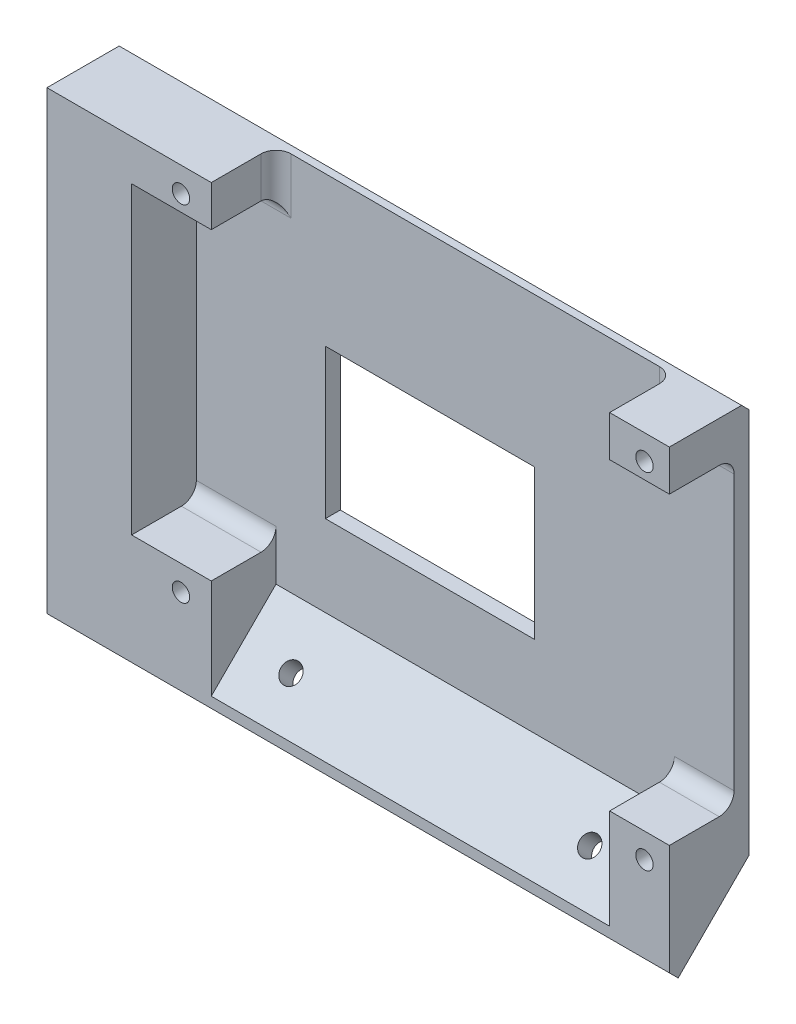
from build123d import *

# Parameters (mm, degrees)
SKETCH_1_W                  = 125
SKETCH_1_H                  = 95
EXTRUDE_1_DEPTH             = 16
SKETCH_3_R                  = 1.75
CUT_EXTRUDE_1_DEPTH         = 158.816348963
CUT_EXTRUDE_2_DEPTH         = 13
CUT_EXTRUDE_3_DEPTH         = 158.816348963
EXTRUDE_4_DEPTH             = 80
HOLE_WIZARD_4_0_4_1_D       = 4
SKETCH_11_W                 = 42
SKETCH_11_H                 = 30
CUT_EXTRUDE_4_DEPTH         = 158.540470991
FILLET_4_R                  = 3
CHAMFER_1_SIZE              = 2.5
CHAMFER_1_SIZE2             = 3.535533906
HOLE_WIZARD_2_5_2_5_1_D     = 2.5
HOLE_WIZARD_2_5_2_5_1_DEPTH = 16
HOLE_WIZARD_2_5_2_5_1_TIP   = 0.751075774
CHAMFER_2_SIZE              = 1.5


with BuildPart() as part:
    # 草图1 → 凸台-拉伸1 (new body)
    with BuildSketch(Plane.XY):
        with Locations((62.5, 47.5)):
            Rectangle(SKETCH_1_W, SKETCH_1_H)
    extrude(amount=EXTRUDE_1_DEPTH)

    # 草图3 → 切除-拉伸1 (cut, through all)
    with BuildSketch(Plane.XY.offset(16)):
        with Locations((26.91, 90)):
            Circle(SKETCH_3_R)
        with Locations((26.91, 20.71)):
            Circle(SKETCH_3_R)
        with Locations((120, 90)):
            Circle(SKETCH_3_R)
        with Locations((120, 20.71)):
            Circle(SKETCH_3_R)
    extrude(amount=-CUT_EXTRUDE_1_DEPTH, mode=Mode.SUBTRACT)

    # 草图4 → 切除-拉伸2 (cut)
    with BuildSketch(Plane.XY.offset(16)):
        Polygon((33, 95), (33, 86.8), (17, 86.8), (17, 25.71), (33, 25.71), (33, 0), (113, 0), (113, 25.71), (125, 25.71), (125, 86.8), (113, 86.8), (113, 95), align=None)
    extrude(amount=-CUT_EXTRUDE_2_DEPTH, mode=Mode.SUBTRACT)

    # 草图5 → 切除-拉伸3 (cut, through all)
    with BuildSketch(Plane(origin=(125, 0, 0), x_dir=(0, 0, -1), z_dir=(1, 0, 0))):
        Polygon((-16, 0), (0, 16), (0, 0), align=None)
    extrude(amount=-CUT_EXTRUDE_3_DEPTH, mode=Mode.SUBTRACT)

    # 草图8 → 凸台-拉伸4 (add)
    with BuildSketch(Plane(origin=(33, 0, 0), x_dir=(0, 0, -1), z_dir=(1, 0, 0))):
        Polygon((-16, 0), (-3, 13), (-3, 18.656854249), (-16, 5.656854249), align=None)
    extrude(amount=EXTRUDE_4_DEPTH)

    # Ø4.0 (4) 直径孔1 (through all)
    with Locations(Plane(origin=(0, 10.828427125, 10.828427125), x_dir=(1, 0, 0), z_dir=(0, 0.7071067811865476, 0.7071067811865476))):
        with Locations((43, 1.186291501), (103, 1.186291501)):
            Hole(HOLE_WIZARD_4_0_4_1_D / 2)

    # 草图11 → 切除-拉伸4 (cut, through all)
    with BuildSketch(Plane.XY.offset(3)):
        with Locations((63.91, 50)):
            Rectangle(SKETCH_11_W, SKETCH_11_H)
    extrude(amount=-CUT_EXTRUDE_4_DEPTH, mode=Mode.SUBTRACT)

    # 圆角4
    fillet_4_edges = [part.edges().sort_by_distance(p)[0] for p in [
        (25, 86.8, 3),
        (113, 90.9, 3),
        (119, 86.8, 3),
        (119, 25.71, 3),
        (25, 25.71, 3),
        (33, 90.9, 3),
    ]]
    fillet(fillet_4_edges, radius=FILLET_4_R)

    # 倒角1
    chamfer_1_edges = [part.edges().sort_by_distance(p)[0] for p in [
        (62.5, 0, 16),
    ]]
    chamfer_1_side = [part.faces().sort_by_distance(p)[0] for p in [
        (62.405862979, 7.992479485, 8.007520515),
    ]]
    chamfer(chamfer_1_edges, length=CHAMFER_1_SIZE, length2=CHAMFER_1_SIZE2, reference=chamfer_1_side[0])

    # Ø2.5 (2.5) 直径孔1
    with Locations(Plane.ZY):
        with Locations((8, 83), (8, 53), (8, 23)):
            Hole(HOLE_WIZARD_2_5_2_5_1_D / 2, depth=HOLE_WIZARD_2_5_2_5_1_DEPTH)
            with Locations((0, 0, -(HOLE_WIZARD_2_5_2_5_1_DEPTH + HOLE_WIZARD_2_5_2_5_1_TIP / 2))):  # 118° drill point
                Cone(0, HOLE_WIZARD_2_5_2_5_1_D / 2, HOLE_WIZARD_2_5_2_5_1_TIP, mode=Mode.SUBTRACT)

    # 倒角2
    chamfer_2_edges = [part.edges().sort_by_distance(p)[0] for p in [
        (62.5, 95, 0),
    ]]
    chamfer(chamfer_2_edges, length=CHAMFER_2_SIZE)


solid = part.part
